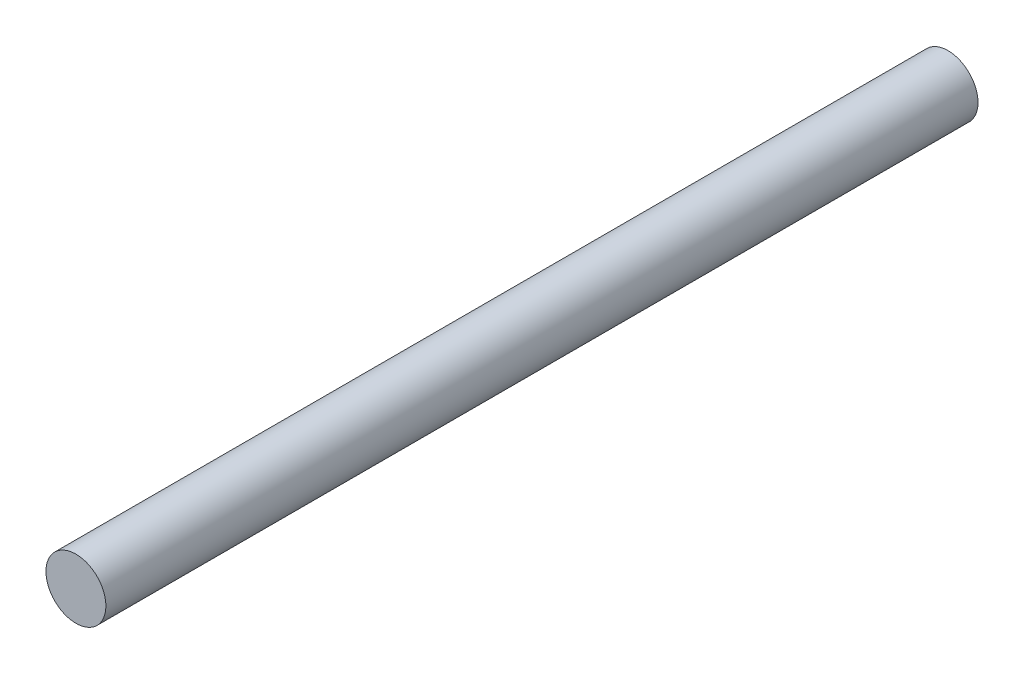
from build123d import *

# Parameters (mm, degrees)
SKETCH1_R           = 5.5
BOSS_EXTRUDE1_DEPTH = 160


with BuildPart() as part:
    # Sketch1 → Boss-Extrude1 (new body)
    with BuildSketch(Plane.XY):
        Circle(SKETCH1_R)
    extrude(amount=BOSS_EXTRUDE1_DEPTH)


solid = part.part
